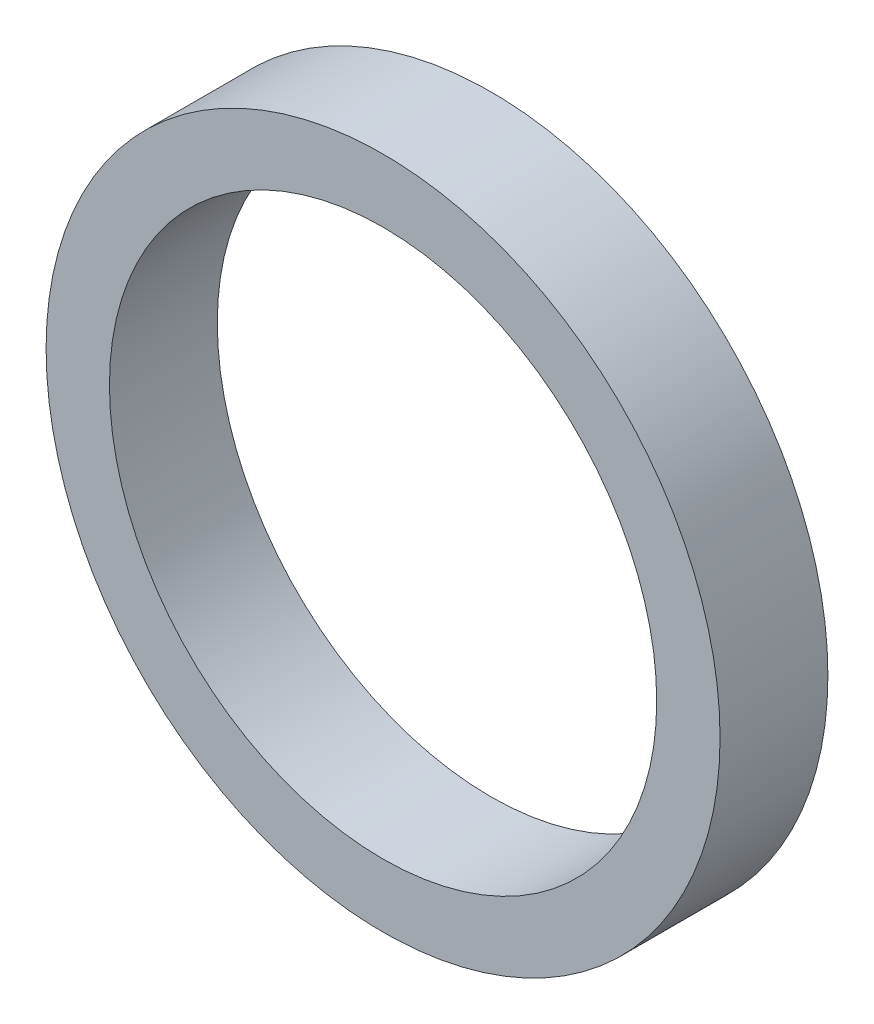
from build123d import *

# Parameters (mm, degrees)
SKETCH_1_R      = 12.5
SKETCH_1_R_2    = 10.15
EXTRUDE_1_DEPTH = 4


with BuildPart() as part:
    # 草图1 → 凸台-拉伸1 (new body)
    with BuildSketch(Plane.XY):
        Circle(SKETCH_1_R)
        Circle(SKETCH_1_R_2, mode=Mode.SUBTRACT)
    extrude(amount=EXTRUDE_1_DEPTH)


solid = part.part
